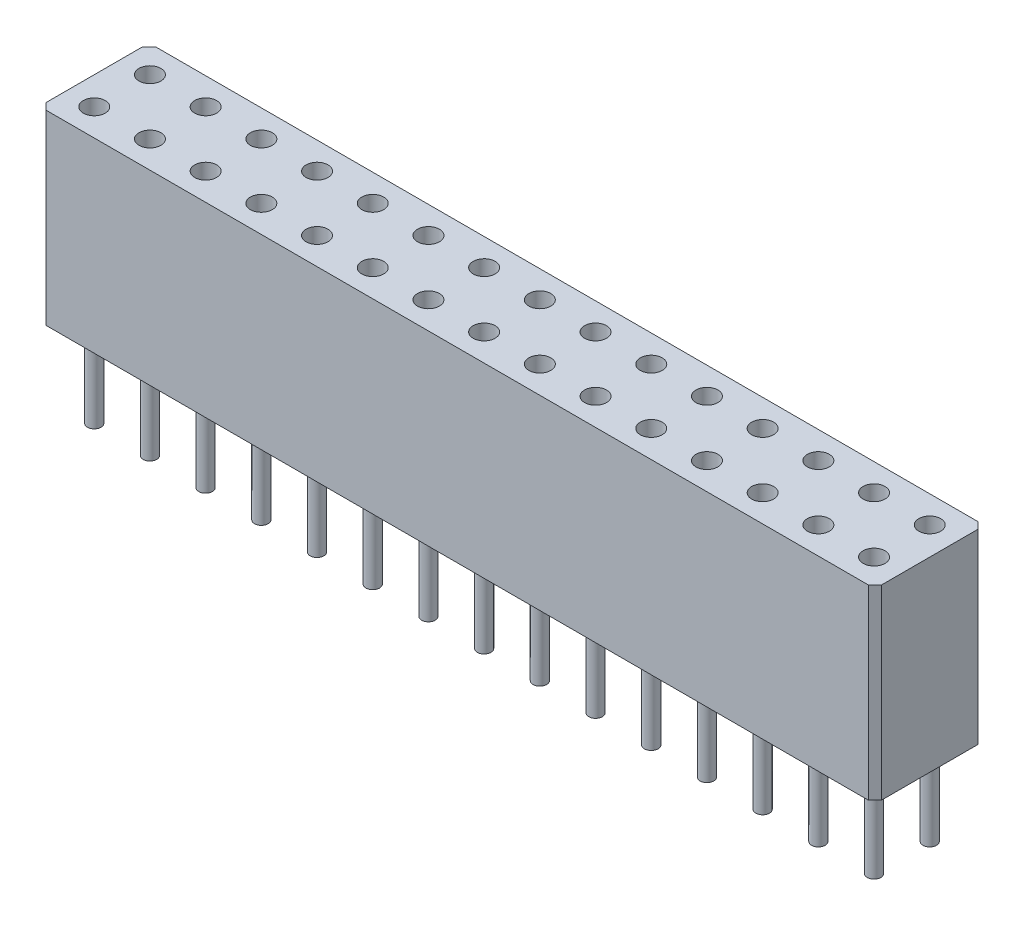
from build123d import *

# Parameters (mm, degrees)
SKETCH_2_R          = 0.31
EXTRUDE_4_DEPTH     = 8.5
SKETCH_7_R          = 0.5
CUT_EXTRUDE_1_DEPTH = 8
SKETCH_8_R          = 0.31
EXTRUDE_5_DEPTH     = 4
EXTRUDE_5_2_DEPTH   = 4
EXTRUDE_5_3_DEPTH   = 4
EXTRUDE_5_4_DEPTH   = 4
EXTRUDE_5_5_DEPTH   = 4
EXTRUDE_5_6_DEPTH   = 4
EXTRUDE_5_7_DEPTH   = 4
EXTRUDE_5_8_DEPTH   = 4
EXTRUDE_5_9_DEPTH   = 4
EXTRUDE_5_10_DEPTH  = 4
EXTRUDE_5_11_DEPTH  = 4
EXTRUDE_5_12_DEPTH  = 4
EXTRUDE_5_13_DEPTH  = 4
EXTRUDE_5_14_DEPTH  = 4
EXTRUDE_5_15_DEPTH  = 4
EXTRUDE_5_16_DEPTH  = 4
EXTRUDE_5_17_DEPTH  = 4
EXTRUDE_5_18_DEPTH  = 4
EXTRUDE_5_19_DEPTH  = 4
EXTRUDE_5_20_DEPTH  = 4
EXTRUDE_5_21_DEPTH  = 4
EXTRUDE_5_22_DEPTH  = 4
EXTRUDE_5_23_DEPTH  = 4
EXTRUDE_5_24_DEPTH  = 4
EXTRUDE_5_25_DEPTH  = 4
EXTRUDE_5_26_DEPTH  = 4
EXTRUDE_5_27_DEPTH  = 4
EXTRUDE_5_28_DEPTH  = 4
EXTRUDE_5_29_DEPTH  = 4
EXTRUDE_5_30_DEPTH  = 4


with BuildPart() as part:
    # Эскиз2 → Бобышка-Вытянуть4 (new body)
    with BuildSketch(Plane(origin=(0, 0, 0), x_dir=(1, 0, 0), z_dir=(0, 1, 0))):
        Polygon((49.411742563, 10.04372655), (74.211742563, 10.04372655), (74.511742563, 10.34372655), (74.511742563, 14.74372655), (74.211742563, 15.04372655), (36.711742563, 15.04372655), (36.411742563, 14.74372655), (36.411742563, 10.34372655), (36.711742563, 10.04372655), align=None)
        with Locations(Location((73.241742563, 11.27372655, 0), (0, 0, 270))):
            Circle(SKETCH_2_R, mode=Mode.SUBTRACT)
        with Locations(Location((70.701742563, 11.27372655, 0), (0, 0, 270))):
            Circle(SKETCH_2_R, mode=Mode.SUBTRACT)
        with Locations(Location((68.161742563, 11.27372655, 0), (0, 0, 270))):
            Circle(SKETCH_2_R, mode=Mode.SUBTRACT)
        with Locations(Location((65.621742563, 11.27372655, 0), (0, 0, 270))):
            Circle(SKETCH_2_R, mode=Mode.SUBTRACT)
        with Locations(Location((63.081742563, 11.27372655, 0), (0, 0, 270))):
            Circle(SKETCH_2_R, mode=Mode.SUBTRACT)
        with Locations(Location((60.541742563, 11.27372655, 0), (0, 0, 270))):
            Circle(SKETCH_2_R, mode=Mode.SUBTRACT)
        with Locations(Location((58.001742563, 11.27372655, 0), (0, 0, 270))):
            Circle(SKETCH_2_R, mode=Mode.SUBTRACT)
        with Locations(Location((55.461742563, 11.27372655, 0), (0, 0, 270))):
            Circle(SKETCH_2_R, mode=Mode.SUBTRACT)
        with Locations(Location((52.921742563, 11.27372655, 0), (0, 0, 270))):
            Circle(SKETCH_2_R, mode=Mode.SUBTRACT)
        with Locations(Location((50.381742563, 11.27372655, 0), (0, 0, 270))):
            Circle(SKETCH_2_R, mode=Mode.SUBTRACT)
        with Locations(Location((47.841742563, 11.27372655, 0), (0, 0, 270))):
            Circle(SKETCH_2_R, mode=Mode.SUBTRACT)
        with Locations(Location((45.301742563, 11.27372655, 0), (0, 0, 270))):
            Circle(SKETCH_2_R, mode=Mode.SUBTRACT)
        with Locations(Location((42.761742563, 11.27372655, 0), (0, 0, 270))):
            Circle(SKETCH_2_R, mode=Mode.SUBTRACT)
        with Locations(Location((40.221742563, 11.27372655, 0), (0, 0, 270))):
            Circle(SKETCH_2_R, mode=Mode.SUBTRACT)
        with Locations(Location((37.681742563, 11.27372655, 0), (0, 0, 270))):
            Circle(SKETCH_2_R, mode=Mode.SUBTRACT)
        with Locations(Location((73.241742563, 13.81372655, 0), (0, 0, 270))):
            Circle(SKETCH_2_R, mode=Mode.SUBTRACT)
        with Locations(Location((70.701742563, 13.81372655, 0), (0, 0, 270))):
            Circle(SKETCH_2_R, mode=Mode.SUBTRACT)
        with Locations(Location((68.161742563, 13.81372655, 0), (0, 0, 270))):
            Circle(SKETCH_2_R, mode=Mode.SUBTRACT)
        with Locations(Location((65.621742563, 13.81372655, 0), (0, 0, 270))):
            Circle(SKETCH_2_R, mode=Mode.SUBTRACT)
        with Locations(Location((63.081742563, 13.81372655, 0), (0, 0, 270))):
            Circle(SKETCH_2_R, mode=Mode.SUBTRACT)
        with Locations(Location((60.541742563, 13.81372655, 0), (0, 0, 270))):
            Circle(SKETCH_2_R, mode=Mode.SUBTRACT)
        with Locations(Location((58.001742563, 13.81372655, 0), (0, 0, 270))):
            Circle(SKETCH_2_R, mode=Mode.SUBTRACT)
        with Locations(Location((55.461742563, 13.81372655, 0), (0, 0, 270))):
            Circle(SKETCH_2_R, mode=Mode.SUBTRACT)
        with Locations(Location((52.921742563, 13.81372655, 0), (0, 0, 270))):
            Circle(SKETCH_2_R, mode=Mode.SUBTRACT)
        with Locations(Location((50.381742563, 13.81372655, 0), (0, 0, 270))):
            Circle(SKETCH_2_R, mode=Mode.SUBTRACT)
        with Locations(Location((47.841742563, 13.81372655, 0), (0, 0, 270))):
            Circle(SKETCH_2_R, mode=Mode.SUBTRACT)
        with Locations(Location((45.301742563, 13.81372655, 0), (0, 0, 270))):
            Circle(SKETCH_2_R, mode=Mode.SUBTRACT)
        with Locations(Location((42.761742563, 13.81372655, 0), (0, 0, 270))):
            Circle(SKETCH_2_R, mode=Mode.SUBTRACT)
        with Locations(Location((40.221742563, 13.81372655, 0), (0, 0, 270))):
            Circle(SKETCH_2_R, mode=Mode.SUBTRACT)
        with Locations(Location((37.681742563, 13.81372655, 0), (0, 0, 270))):
            Circle(SKETCH_2_R, mode=Mode.SUBTRACT)
    extrude(amount=-EXTRUDE_4_DEPTH)

    # Эскиз7 → Вырез-Вытянуть1 (cut)
    with BuildSketch(Plane(origin=(0, 0, 0), x_dir=(1, 0, 0), z_dir=(0, 1, 0))):
        with Locations((83.401742563, 11.27372655)):
            Circle(SKETCH_7_R)
        with Locations((80.861742563, 11.27372655)):
            Circle(SKETCH_7_R)
        with Locations((78.321742563, 11.27372655)):
            Circle(SKETCH_7_R)
        with Locations((75.781742563, 11.27372655)):
            Circle(SKETCH_7_R)
        with Locations(Location((73.241742563, 11.27372655, 0), (0, 0, 270))):
            Circle(SKETCH_7_R)
        with Locations(Location((70.701742563, 11.27372655, 0), (0, 0, 270))):
            Circle(SKETCH_7_R)
        with Locations(Location((68.161742563, 11.27372655, 0), (0, 0, 270))):
            Circle(SKETCH_7_R)
        with Locations(Location((65.621742563, 11.27372655, 0), (0, 0, 270))):
            Circle(SKETCH_7_R)
        with Locations(Location((63.081742563, 11.27372655, 0), (0, 0, 270))):
            Circle(SKETCH_7_R)
        with Locations(Location((60.541742563, 11.27372655, 0), (0, 0, 270))):
            Circle(SKETCH_7_R)
        with Locations(Location((58.001742563, 11.27372655, 0), (0, 0, 270))):
            Circle(SKETCH_7_R)
        with Locations(Location((55.461742563, 11.27372655, 0), (0, 0, 270))):
            Circle(SKETCH_7_R)
        with Locations(Location((52.921742563, 11.27372655, 0), (0, 0, 270))):
            Circle(SKETCH_7_R)
        with Locations(Location((50.381742563, 11.27372655, 0), (0, 0, 270))):
            Circle(SKETCH_7_R)
        with Locations(Location((47.841742563, 11.27372655, 0), (0, 0, 270))):
            Circle(SKETCH_7_R)
        with Locations(Location((45.301742563, 11.27372655, 0), (0, 0, 270))):
            Circle(SKETCH_7_R)
        with Locations(Location((42.761742563, 11.27372655, 0), (0, 0, 270))):
            Circle(SKETCH_7_R)
        with Locations(Location((40.221742563, 11.27372655, 0), (0, 0, 270))):
            Circle(SKETCH_7_R)
        with Locations(Location((37.681742563, 11.27372655, 0), (0, 0, 270))):
            Circle(SKETCH_7_R)
        with Locations((83.401742563, 13.81372655)):
            Circle(SKETCH_7_R)
        with Locations((80.861742563, 13.81372655)):
            Circle(SKETCH_7_R)
        with Locations((78.321742563, 13.81372655)):
            Circle(SKETCH_7_R)
        with Locations((75.781742563, 13.81372655)):
            Circle(SKETCH_7_R)
        with Locations(Location((73.241742563, 13.81372655, 0), (0, 0, 270))):
            Circle(SKETCH_7_R)
        with Locations(Location((70.701742563, 13.81372655, 0), (0, 0, 270))):
            Circle(SKETCH_7_R)
        with Locations(Location((68.161742563, 13.81372655, 0), (0, 0, 270))):
            Circle(SKETCH_7_R)
        with Locations(Location((65.621742563, 13.81372655, 0), (0, 0, 270))):
            Circle(SKETCH_7_R)
        with Locations(Location((63.081742563, 13.81372655, 0), (0, 0, 270))):
            Circle(SKETCH_7_R)
        with Locations(Location((60.541742563, 13.81372655, 0), (0, 0, 270))):
            Circle(SKETCH_7_R)
        with Locations((85.941742563, 11.27372655)):
            Circle(SKETCH_7_R)
        with Locations(Location((58.001742563, 13.81372655, 0), (0, 0, 270))):
            Circle(SKETCH_7_R)
        with Locations(Location((55.461742563, 13.81372655, 0), (0, 0, 270))):
            Circle(SKETCH_7_R)
        with Locations(Location((52.921742563, 13.81372655, 0), (0, 0, 270))):
            Circle(SKETCH_7_R)
        with Locations(Location((50.381742563, 13.81372655, 0), (0, 0, 270))):
            Circle(SKETCH_7_R)
        with Locations(Location((47.841742563, 13.81372655, 0), (0, 0, 270))):
            Circle(SKETCH_7_R)
        with Locations(Location((45.301742563, 13.81372655, 0), (0, 0, 270))):
            Circle(SKETCH_7_R)
        with Locations(Location((42.761742563, 13.81372655, 0), (0, 0, 270))):
            Circle(SKETCH_7_R)
        with Locations(Location((40.221742563, 13.81372655, 0), (0, 0, 270))):
            Circle(SKETCH_7_R)
        with Locations(Location((37.681742563, 13.81372655, 0), (0, 0, 270))):
            Circle(SKETCH_7_R)
        with Locations((85.941742563, 13.81372655)):
            Circle(SKETCH_7_R)
    extrude(amount=-CUT_EXTRUDE_1_DEPTH, mode=Mode.SUBTRACT)


with BuildPart() as body_2:
    # Эскиз8 → Бобышка-Вытянуть5 (new body)
    with BuildSketch(Plane.XZ.offset(8.5)):
        with Locations(Location((37.681742563, -11.27372655, 0), (0, 0, 270))):
            Circle(SKETCH_8_R)
    extrude(amount=EXTRUDE_5_DEPTH)


with BuildPart() as body_3:
    # Эскиз8 → Extrude 5 2 (new body)
    with BuildSketch(Plane.XZ.offset(8.5)):
        with Locations(Location((40.221742563, -11.27372655, 0), (0, 0, 270))):
            Circle(SKETCH_8_R)
    extrude(amount=EXTRUDE_5_2_DEPTH)


with BuildPart() as body_4:
    # Эскиз8 → Extrude 5 3 (new body)
    with BuildSketch(Plane.XZ.offset(8.5)):
        with Locations(Location((42.761742563, -11.27372655, 0), (0, 0, 270))):
            Circle(SKETCH_8_R)
    extrude(amount=EXTRUDE_5_3_DEPTH)


with BuildPart() as body_5:
    # Эскиз8 → Extrude 5 4 (new body)
    with BuildSketch(Plane.XZ.offset(8.5)):
        with Locations(Location((45.301742563, -11.27372655, 0), (0, 0, 270))):
            Circle(SKETCH_8_R)
    extrude(amount=EXTRUDE_5_4_DEPTH)


with BuildPart() as body_6:
    # Эскиз8 → Extrude 5 5 (new body)
    with BuildSketch(Plane.XZ.offset(8.5)):
        with Locations(Location((47.841742563, -11.27372655, 0), (0, 0, 270))):
            Circle(SKETCH_8_R)
    extrude(amount=EXTRUDE_5_5_DEPTH)


with BuildPart() as body_7:
    # Эскиз8 → Extrude 5 6 (new body)
    with BuildSketch(Plane.XZ.offset(8.5)):
        with Locations(Location((50.381742563, -11.27372655, 0), (0, 0, 270))):
            Circle(SKETCH_8_R)
    extrude(amount=EXTRUDE_5_6_DEPTH)


with BuildPart() as body_8:
    # Эскиз8 → Extrude 5 7 (new body)
    with BuildSketch(Plane.XZ.offset(8.5)):
        with Locations(Location((52.921742563, -11.27372655, 0), (0, 0, 270))):
            Circle(SKETCH_8_R)
    extrude(amount=EXTRUDE_5_7_DEPTH)


with BuildPart() as body_9:
    # Эскиз8 → Extrude 5 8 (new body)
    with BuildSketch(Plane.XZ.offset(8.5)):
        with Locations(Location((55.461742563, -11.27372655, 0), (0, 0, 270))):
            Circle(SKETCH_8_R)
    extrude(amount=EXTRUDE_5_8_DEPTH)


with BuildPart() as body_10:
    # Эскиз8 → Extrude 5 9 (new body)
    with BuildSketch(Plane.XZ.offset(8.5)):
        with Locations(Location((58.001742563, -11.27372655, 0), (0, 0, 270))):
            Circle(SKETCH_8_R)
    extrude(amount=EXTRUDE_5_9_DEPTH)


with BuildPart() as body_11:
    # Эскиз8 → Extrude 5 10 (new body)
    with BuildSketch(Plane.XZ.offset(8.5)):
        with Locations(Location((60.541742563, -11.27372655, 0), (0, 0, 270))):
            Circle(SKETCH_8_R)
    extrude(amount=EXTRUDE_5_10_DEPTH)


with BuildPart() as body_12:
    # Эскиз8 → Extrude 5 11 (new body)
    with BuildSketch(Plane.XZ.offset(8.5)):
        with Locations(Location((63.081742563, -11.27372655, 0), (0, 0, 270))):
            Circle(SKETCH_8_R)
    extrude(amount=EXTRUDE_5_11_DEPTH)


with BuildPart() as body_13:
    # Эскиз8 → Extrude 5 12 (new body)
    with BuildSketch(Plane.XZ.offset(8.5)):
        with Locations(Location((65.621742563, -11.27372655, 0), (0, 0, 270))):
            Circle(SKETCH_8_R)
    extrude(amount=EXTRUDE_5_12_DEPTH)


with BuildPart() as body_14:
    # Эскиз8 → Extrude 5 13 (new body)
    with BuildSketch(Plane.XZ.offset(8.5)):
        with Locations(Location((68.161742563, -11.27372655, 0), (0, 0, 270))):
            Circle(SKETCH_8_R)
    extrude(amount=EXTRUDE_5_13_DEPTH)


with BuildPart() as body_15:
    # Эскиз8 → Extrude 5 14 (new body)
    with BuildSketch(Plane.XZ.offset(8.5)):
        with Locations(Location((70.701742563, -11.27372655, 0), (0, 0, 270))):
            Circle(SKETCH_8_R)
    extrude(amount=EXTRUDE_5_14_DEPTH)


with BuildPart() as body_16:
    # Эскиз8 → Extrude 5 15 (new body)
    with BuildSketch(Plane.XZ.offset(8.5)):
        with Locations(Location((73.241742563, -11.27372655, 0), (0, 0, 270))):
            Circle(SKETCH_8_R)
    extrude(amount=EXTRUDE_5_15_DEPTH)


with BuildPart() as body_17:
    # Эскиз8 → Extrude 5 16 (new body)
    with BuildSketch(Plane.XZ.offset(8.5)):
        with Locations(Location((40.221742563, -13.81372655, 0), (0, 0, 270))):
            Circle(SKETCH_8_R)
    extrude(amount=EXTRUDE_5_16_DEPTH)


with BuildPart() as body_18:
    # Эскиз8 → Extrude 5 17 (new body)
    with BuildSketch(Plane.XZ.offset(8.5)):
        with Locations(Location((42.761742563, -13.81372655, 0), (0, 0, 270))):
            Circle(SKETCH_8_R)
    extrude(amount=EXTRUDE_5_17_DEPTH)


with BuildPart() as body_19:
    # Эскиз8 → Extrude 5 18 (new body)
    with BuildSketch(Plane.XZ.offset(8.5)):
        with Locations(Location((45.301742563, -13.81372655, 0), (0, 0, 270))):
            Circle(SKETCH_8_R)
    extrude(amount=EXTRUDE_5_18_DEPTH)


with BuildPart() as body_20:
    # Эскиз8 → Extrude 5 19 (new body)
    with BuildSketch(Plane.XZ.offset(8.5)):
        with Locations(Location((47.841742563, -13.81372655, 0), (0, 0, 270))):
            Circle(SKETCH_8_R)
    extrude(amount=EXTRUDE_5_19_DEPTH)


with BuildPart() as body_21:
    # Эскиз8 → Extrude 5 20 (new body)
    with BuildSketch(Plane.XZ.offset(8.5)):
        with Locations(Location((50.381742563, -13.81372655, 0), (0, 0, 270))):
            Circle(SKETCH_8_R)
    extrude(amount=EXTRUDE_5_20_DEPTH)


with BuildPart() as body_22:
    # Эскиз8 → Extrude 5 21 (new body)
    with BuildSketch(Plane.XZ.offset(8.5)):
        with Locations(Location((52.921742563, -13.81372655, 0), (0, 0, 270))):
            Circle(SKETCH_8_R)
    extrude(amount=EXTRUDE_5_21_DEPTH)


with BuildPart() as body_23:
    # Эскиз8 → Extrude 5 22 (new body)
    with BuildSketch(Plane.XZ.offset(8.5)):
        with Locations(Location((55.461742563, -13.81372655, 0), (0, 0, 270))):
            Circle(SKETCH_8_R)
    extrude(amount=EXTRUDE_5_22_DEPTH)


with BuildPart() as body_24:
    # Эскиз8 → Extrude 5 23 (new body)
    with BuildSketch(Plane.XZ.offset(8.5)):
        with Locations(Location((58.001742563, -13.81372655, 0), (0, 0, 270))):
            Circle(SKETCH_8_R)
    extrude(amount=EXTRUDE_5_23_DEPTH)


with BuildPart() as body_25:
    # Эскиз8 → Extrude 5 24 (new body)
    with BuildSketch(Plane.XZ.offset(8.5)):
        with Locations(Location((60.541742563, -13.81372655, 0), (0, 0, 270))):
            Circle(SKETCH_8_R)
    extrude(amount=EXTRUDE_5_24_DEPTH)


with BuildPart() as body_26:
    # Эскиз8 → Extrude 5 25 (new body)
    with BuildSketch(Plane.XZ.offset(8.5)):
        with Locations(Location((63.081742563, -13.81372655, 0), (0, 0, 270))):
            Circle(SKETCH_8_R)
    extrude(amount=EXTRUDE_5_25_DEPTH)


with BuildPart() as body_27:
    # Эскиз8 → Extrude 5 26 (new body)
    with BuildSketch(Plane.XZ.offset(8.5)):
        with Locations(Location((65.621742563, -13.81372655, 0), (0, 0, 270))):
            Circle(SKETCH_8_R)
    extrude(amount=EXTRUDE_5_26_DEPTH)


with BuildPart() as body_28:
    # Эскиз8 → Extrude 5 27 (new body)
    with BuildSketch(Plane.XZ.offset(8.5)):
        with Locations(Location((68.161742563, -13.81372655, 0), (0, 0, 270))):
            Circle(SKETCH_8_R)
    extrude(amount=EXTRUDE_5_27_DEPTH)


with BuildPart() as body_29:
    # Эскиз8 → Extrude 5 28 (new body)
    with BuildSketch(Plane.XZ.offset(8.5)):
        with Locations(Location((70.701742563, -13.81372655, 0), (0, 0, 270))):
            Circle(SKETCH_8_R)
    extrude(amount=EXTRUDE_5_28_DEPTH)


with BuildPart() as body_30:
    # Эскиз8 → Extrude 5 29 (new body)
    with BuildSketch(Plane.XZ.offset(8.5)):
        with Locations(Location((73.241742563, -13.81372655, 0), (0, 0, 270))):
            Circle(SKETCH_8_R)
    extrude(amount=EXTRUDE_5_29_DEPTH)


with BuildPart() as body_31:
    # Эскиз8 → Extrude 5 30 (new body)
    with BuildSketch(Plane.XZ.offset(8.5)):
        with Locations(Location((37.681742563, -13.81372655, 0), (0, 0, 270))):
            Circle(SKETCH_8_R)
    extrude(amount=EXTRUDE_5_30_DEPTH)


solid = Compound([part.part, body_2.part, body_3.part, body_4.part, body_5.part, body_6.part, body_7.part, body_8.part, body_9.part, body_10.part, body_11.part, body_12.part, body_13.part, body_14.part, body_15.part, body_16.part, body_17.part, body_18.part, body_19.part, body_20.part, body_21.part, body_22.part, body_23.part, body_24.part, body_25.part, body_26.part, body_27.part, body_28.part, body_29.part, body_30.part, body_31.part])
